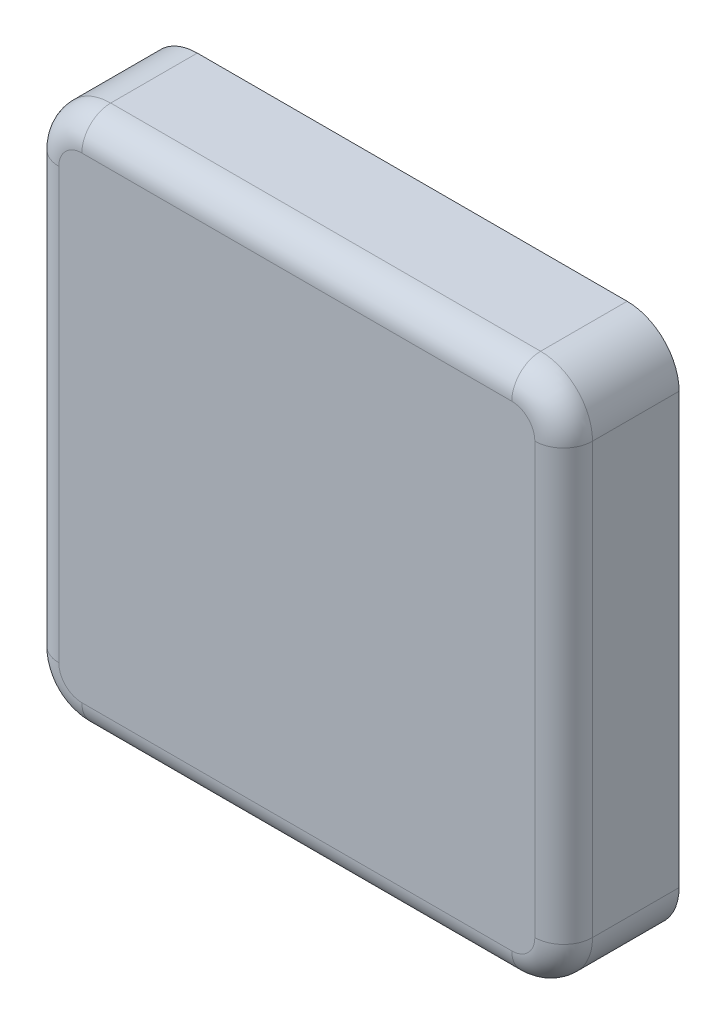
from build123d import *

# Parameters (mm, degrees)
SCHIZZO1_W                   = 18.5
SCHIZZO1_H                   = 18.5
ESTRUSIONE_ESTRUSIONE1_DEPTH = 4
RACCORDO1_R                  = 1.8
RACCORDO2_R                  = 1
SVUOTA1_T                    = -2
SMUSSO1_SIZE                 = 1.4


with BuildPart() as part:
    # Schizzo1 → Estrusione-Estrusione1 (new body)
    with BuildSketch(Plane.XY):
        Rectangle(SCHIZZO1_W, SCHIZZO1_H)
    extrude(amount=ESTRUSIONE_ESTRUSIONE1_DEPTH)

    # Raccordo1
    raccordo1_edges = [part.edges().sort_by_distance(p)[0] for p in [
        (9.25, -9.25, 2),
        (-9.25, -9.25, 2),
        (-9.25, 9.25, 2),
        (9.25, 9.25, 2),
    ]]
    fillet(raccordo1_edges, radius=RACCORDO1_R)

    # Raccordo2
    raccordo2_edges = [part.edges().sort_by_distance(p)[0] for p in [
        (-9.25, 0, 4),
        (0, 9.25, 4),
        (9.25, 0, 4),
        (0, -9.25, 4),
        (8.722792206, 8.722792206, 4),
        (8.722792206, -8.722792206, 4),
        (-8.722792206, -8.722792206, 4),
        (-8.722792206, 8.722792206, 4),
    ]]
    fillet(raccordo2_edges, radius=RACCORDO2_R)

    # Svuota1
    svuota1_openings = [part.faces().sort_by_distance(p)[0] for p in [
        (0, 0, 0),
    ]]
    offset(amount=SVUOTA1_T, openings=svuota1_openings, kind=Kind.INTERSECTION)

    # Smusso1
    smusso1_edges = [part.edges().sort_by_distance(p)[0] for p in [
        (7.25, 0, 0),
        (0, 7.25, 0),
        (-7.25, 0, 0),
        (0, -7.25, 0),
    ]]
    chamfer(smusso1_edges, length=SMUSSO1_SIZE)


solid = part.part
